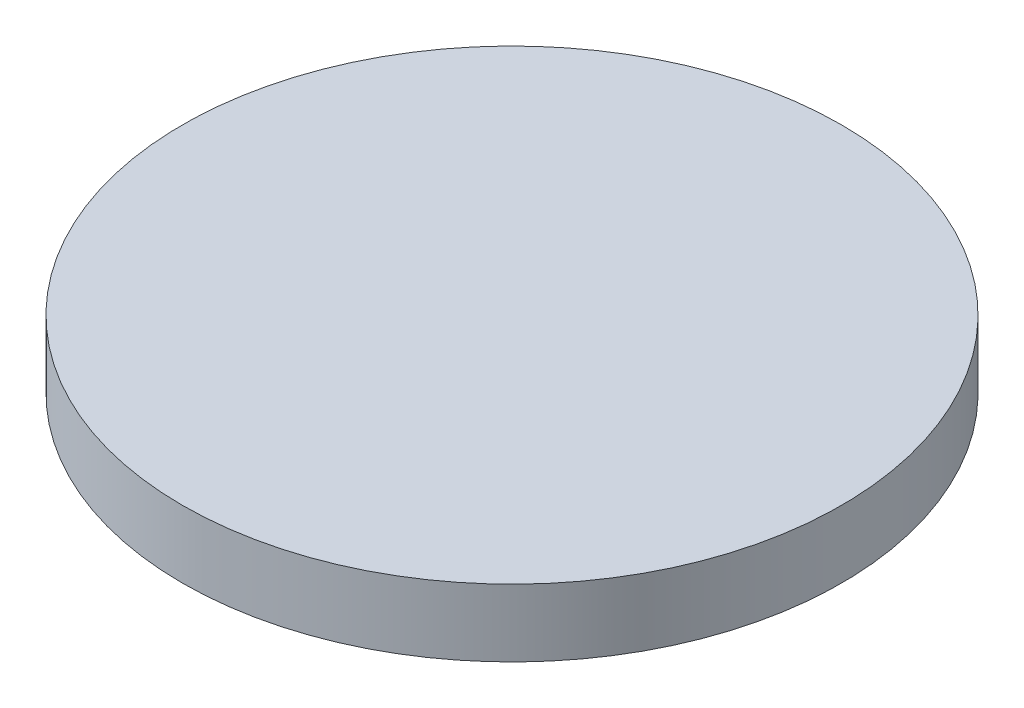
from build123d import *

# Parameters (mm, degrees)
SKETCH_1_R      = 89.215
EXTRUDE_1_DEPTH = 18.24


with BuildPart() as part:
    # 草图1 → 凸台-拉伸1 (new body)
    with BuildSketch(Plane(origin=(0, 0, 0), x_dir=(1, 0, 0), z_dir=(0, 1, 0))):
        with Locations(Location((0, 0, 0), (0, 0, 270))):
            Circle(SKETCH_1_R)
    extrude(amount=EXTRUDE_1_DEPTH)


solid = part.part
